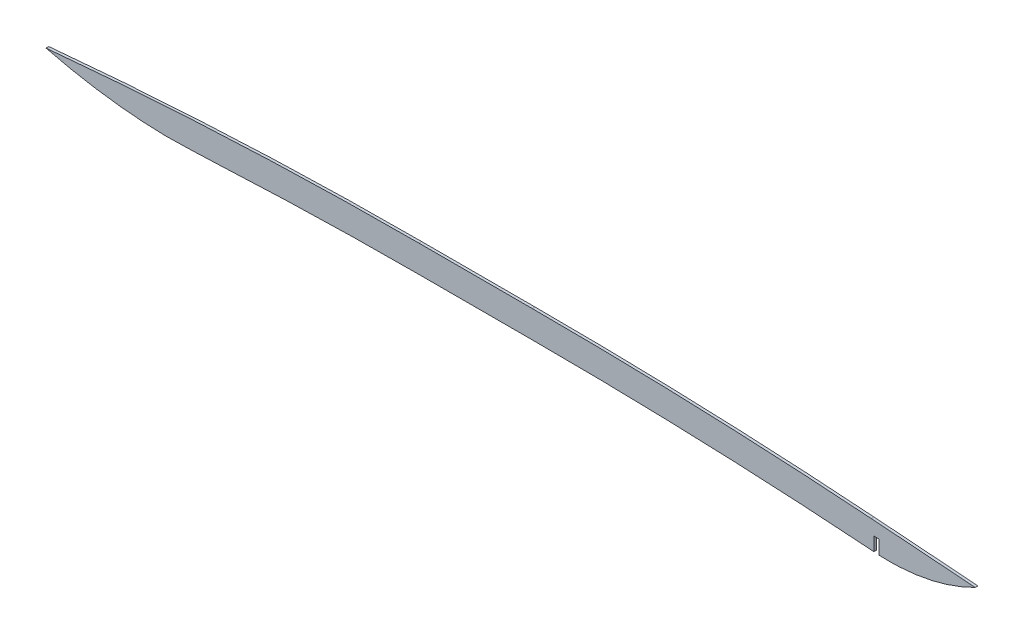
from build123d import *

# Parameters (mm, degrees)
BOSS_EXTRUDE1_DEPTH = 10
CUT_EXTRUDE1_DEPTH  = 3710.862109794


with BuildPart() as part:
    # Sketch1 → Boss-Extrude1 (new body)
    with BuildSketch(Plane.XY):
        with BuildLine():
            ThreePointArc((927.370608086, -23.902888447), (1293.351644263, -10.035647291), (1659.566121622, -5.412251186))
            Line((1659.566121622, -5.412251186), (2076.89523305, -5.412251186))
            ThreePointArc((2076.89523305, -5.412251186), (2375.641258252, -8.033022811), (2674.295326878, -15.894530989))
            ThreePointArc((2674.295326878, -15.894530989), (2807.667775437, -21.099833603), (2940.995326878, -27.350372482))
            ThreePointArc((2940.995326878, -27.350372482), (3129.39992894, -37.970043076), (3317.675281863, -50.676850811))
            ThreePointArc((3317.675281863, -50.676850811), (3336.316403493, -52.042821656), (3354.957429761, -53.410093259))
            add(Edge.make_bspline(
                [(3708.642612964, 20.678794226), (3542.658351866, -62.676383397), (3354.957429761, -53.410093259)],
                knots=[0, 0, 0, 0.910126354, 0.910126354, 0.910126354], degree=2))
            ThreePointArc((3708.642612964, 20.678794226), (3516.807267992, 34.936923471), (3324.961736788, 49.057333773))
            ThreePointArc((3324.961736788, 49.057333773), (3135.580740786, 61.838761971), (2946.069736633, 72.520796359))
            ThreePointArc((2946.069736633, 72.520796359), (2811.95922193, 78.808041397), (2677.803546453, 84.043912041))
            ThreePointArc((2677.803546453, 84.043912041), (2377.395638046, 91.951586762), (2076.89523305, 94.587748814))
            Line((2076.89523305, 94.587748814), (1659.566121622, 94.587748814))
            ThreePointArc((1659.566121622, 94.587748814), (1174.01952466, 86.51504314), (689.009647082, 62.305849623))
            ThreePointArc((689.009647082, 62.305849623), (487.518786709, 47.486939475), (286.252176699, 29.882434183))
            add(Edge.make_bspline(
                [(286.252176699, 29.882434183), (504.29651375, -25.388068548), (725.000553962, -30.129594175)],
                knots=[0, 0, 0, 0.68624514, 0.68624514, 0.68624514], degree=2))
            add(Edge.make_bspline(
                [(725.000553962, -30.129594175), (826.134643966, -28.608253563), (927.370608086, -23.902888447)],
                knots=[0.782175284, 0.782175284, 0.782175284, 1, 1, 1], degree=2))
        make_face()
    extrude(amount=BOSS_EXTRUDE1_DEPTH)

    # Sketch2 → Cut-Extrude1 (cut, through all)
    with BuildSketch(Plane.XY.offset(10)):
        with BuildLine():
            Line((3354.957429764, -53.410093259), (3354.957429764, -1.943195553))
            Line((3354.957429764, -1.943195553), (3334.957429764, -1.943195553))
            Line((3334.957429764, -1.943195553), (3334.957429764, -51.943195553))
            ThreePointArc((3334.957429764, -51.943195553), (3344.957443491, -52.67645724), (3354.957429764, -53.410093259))
        make_face()
    extrude(amount=-CUT_EXTRUDE1_DEPTH, mode=Mode.SUBTRACT)


solid = part.part
